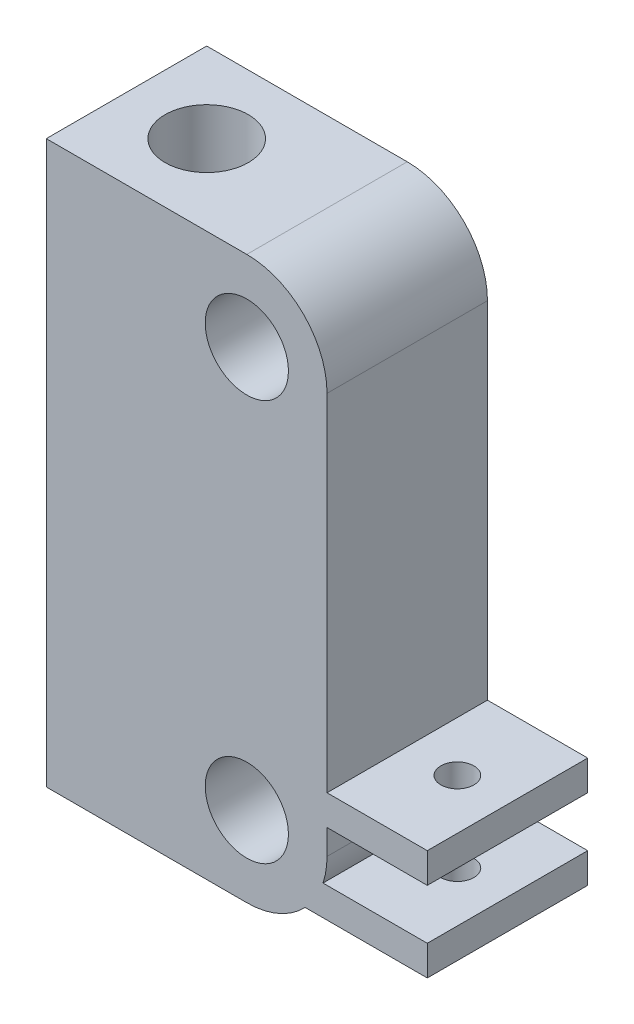
from build123d import *

# Parameters (mm, degrees)
SKETCH1_R           = 4.15
BOSS_EXTRUDE1_DEPTH = 16
SKETCH2_R           = 4.15
CUT_EXTRUDE1_DEPTH  = 63.237043653
SKETCH3_R           = 1.65
CUT_EXTRUDE2_DEPTH  = 51.435102881


with BuildPart() as part:
    # Sketch1 → Boss-Extrude1 (new body)
    with BuildSketch(Plane.XY):
        with BuildLine():
            Line((11.941959863, -20.868835105), (21.941959863, -20.868835105))
            Line((21.941959863, -20.868835105), (21.941959863, -23.868835105))
            Line((21.941959863, -23.868835105), (11.941959863, -23.868835105))
            Line((11.941959863, -23.868835105), (11.941959863, -26.368835105))
            ThreePointArc((11.941959863, -26.368835105), (11.841160348, -27.63478601), (11.541301939, -28.868835105))
            Line((11.541301939, -28.868835105), (21.941959863, -28.868835105))
            Line((21.941959863, -28.868835105), (21.941959863, -31.868835105))
            Line((21.941959863, -31.868835105), (9.751434882, -31.868835105))
            ThreePointArc((9.751434882, -31.868835105), (7.104237523, -33.717304334), (3.941959863, -34.368835105))
            Line((3.941959863, -34.368835105), (-16.058040137, -34.368835105))
            Line((-16.058040137, -34.368835105), (-16.058040137, 21.631164895))
            Line((-16.058040137, 21.631164895), (3.941959863, 21.631164895))
            ThreePointArc((3.941959863, 21.631164895), (9.598814112, 19.288019144), (11.941959863, 13.631164895))
            Line((11.941959863, 13.631164895), (11.941959863, -20.868835105))
        make_face()
        with Locations((3.941959863, 13.631164895)):
            Circle(SKETCH1_R, mode=Mode.SUBTRACT)
        with Locations((3.941959863, -26.368835105)):
            Circle(SKETCH1_R, mode=Mode.SUBTRACT)
    extrude(amount=-BOSS_EXTRUDE1_DEPTH)

    # Sketch2 → Cut-Extrude1 (cut, through all)
    with BuildSketch(Plane(origin=(0, 21.631164895, 0), x_dir=(1, 0, 0), z_dir=(0, 1, 0))):
        with Locations(Location((-8.058040137, 8, 0), (0, 0, 270))):
            Circle(SKETCH2_R)
    extrude(amount=-CUT_EXTRUDE1_DEPTH, mode=Mode.SUBTRACT)

    # Sketch3 → Cut-Extrude2 (cut, through all)
    with BuildSketch(Plane(origin=(0, -20.868835105, 0), x_dir=(1, 0, 0), z_dir=(0, 1, 0))):
        with Locations(Location((16.941959863, 8, 0), (0, 0, 270))):
            Circle(SKETCH3_R)
    extrude(amount=-CUT_EXTRUDE2_DEPTH, mode=Mode.SUBTRACT)


solid = part.part
